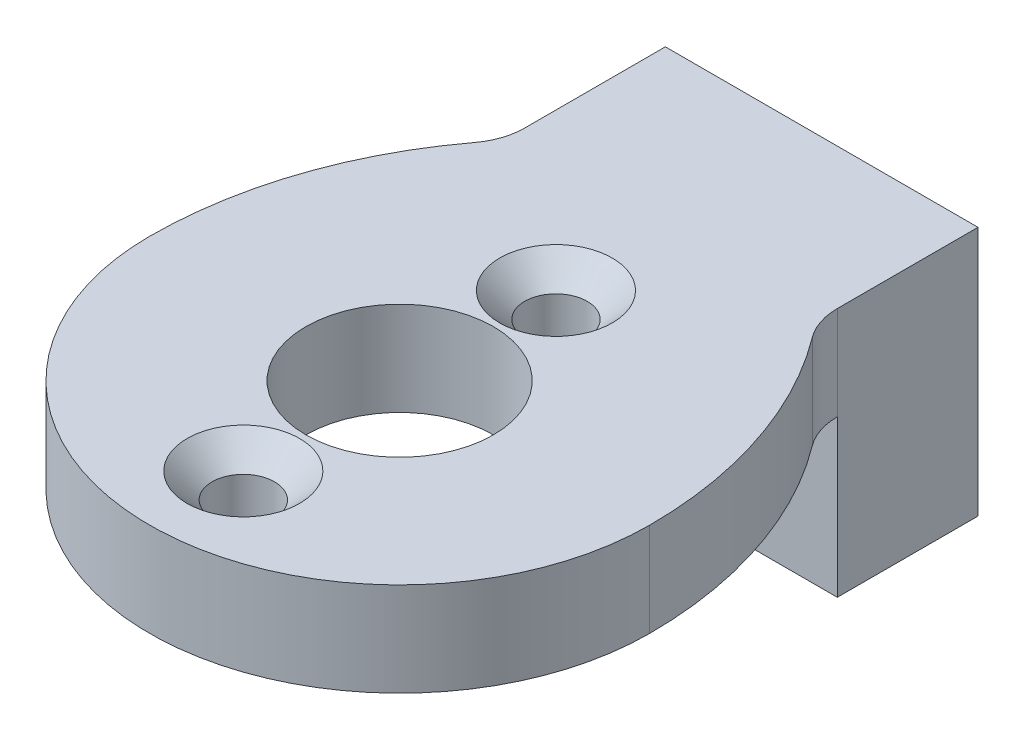
from build123d import *

# Parameters (mm, degrees)
BOSS_EXTRUDE1_DEPTH           = 3
SKETCH2_W                     = 10
SKETCH2_H                     = 4.5
BOSS_EXTRUDE2_DEPTH           = 5
F_6_0_6_DIAMETER_HOLE1_D      = 6
M3X0_5_TAPPED_HOLE1_D         = 2.5
M2X0_4_TAPPED_HOLE1_D         = 1.6
M2X0_4_TAPPED_HOLE1_DEPTH     = 5.2
M2X0_4_TAPPED_HOLE1_TIP       = 0.480688495
FILLET1_R                     = 2
CSK_FOR_M3_SFHCS3_D           = 2
CSK_FOR_M3_SFHCS3_DEPTH       = 9.5
CSK_FOR_M3_SFHCS3_CSINK_D     = 3.6
CSK_FOR_M3_SFHCS3_CSINK_ANGLE = 90
CSK_FOR_M3_SFHCS3_TIP         = 0.600860619


with BuildPart() as part:
    # Sketch1 → Boss-Extrude1 (new body)
    with BuildSketch(Plane(origin=(0, 3, 0), x_dir=(1, 0, 0), z_dir=(0, 1, 0))):
        with BuildLine():
            Line((5.000000003, -5.193376137), (5.000000003, 0))
            Line((5.000000003, 0), (-4.999999997, 0))
            Line((-4.999999997, 0), (-4.999999997, -5.193376137))
            ThreePointArc((-4.999999997, -5.193376137), (-7.227019257, -9.084119567), (-7.999999997, -13.5))
            ThreePointArc((-7.999999997, -13.5), (3e-09, -21.5), (8.000000003, -13.5))
            ThreePointArc((8.000000003, -13.5), (7.227019264, -9.084119567), (5.000000003, -5.193376137))
        make_face()
    extrude(amount=-BOSS_EXTRUDE1_DEPTH)

    # Sketch2 → Boss-Extrude2 (add)
    with BuildSketch(Plane.XZ):
        with Locations((0, 2.25)):
            Rectangle(SKETCH2_W, SKETCH2_H)
    extrude(amount=BOSS_EXTRUDE2_DEPTH)

    # Ø6.0 (6) Diameter Hole1 (through all)
    with Locations(Plane(origin=(0, 0, 0), x_dir=(-1, 0, 0), z_dir=(0, -1, 0))):
        with Locations((0, -13.5)):
            Hole(F_6_0_6_DIAMETER_HOLE1_D / 2)

    # M3x0.5 Tapped Hole1 (through all)
    with Locations(Plane(origin=(0, 0, 0), x_dir=(-1, 0, 0), z_dir=(0, 0, -1))):
        with Locations((-1.5, -2)):
            Hole(M3X0_5_TAPPED_HOLE1_D / 2)

    # M2x0.4 Tapped Hole1
    with Locations(Plane(origin=(0, 0, 0), x_dir=(-1, 0, 0), z_dir=(0, 0, -1))):
        with Locations((3, 1)):
            Hole(M2X0_4_TAPPED_HOLE1_D / 2, depth=M2X0_4_TAPPED_HOLE1_DEPTH)
            with Locations((0, 0, -(M2X0_4_TAPPED_HOLE1_DEPTH + M2X0_4_TAPPED_HOLE1_TIP / 2))):  # 118° drill point
                Cone(0, M2X0_4_TAPPED_HOLE1_D / 2, M2X0_4_TAPPED_HOLE1_TIP, mode=Mode.SUBTRACT)

    # Fillet1
    fillet1_edges = [part.edges().sort_by_distance(p)[0] for p in [
        (5.000000003, 1.5, 5.193376137),
        (-4.999999997, 1.5, 5.193376137),
    ]]
    fillet(fillet1_edges, radius=FILLET1_R)

    # CSK for M3 SFHCS3
    with Locations(Plane(origin=(3e-09, 3, 8.5), x_dir=(0, 0, 1), z_dir=(0, 1, 0))):
        with Locations((0, 0), (10, 0)):
            CounterSinkHole(CSK_FOR_M3_SFHCS3_D / 2, CSK_FOR_M3_SFHCS3_CSINK_D / 2, depth=CSK_FOR_M3_SFHCS3_DEPTH, counter_sink_angle=CSK_FOR_M3_SFHCS3_CSINK_ANGLE)
            with Locations((0, 0, -(CSK_FOR_M3_SFHCS3_DEPTH + CSK_FOR_M3_SFHCS3_TIP / 2))):  # 118° drill point
                Cone(0, CSK_FOR_M3_SFHCS3_D / 2, CSK_FOR_M3_SFHCS3_TIP, mode=Mode.SUBTRACT)


solid = part.part
